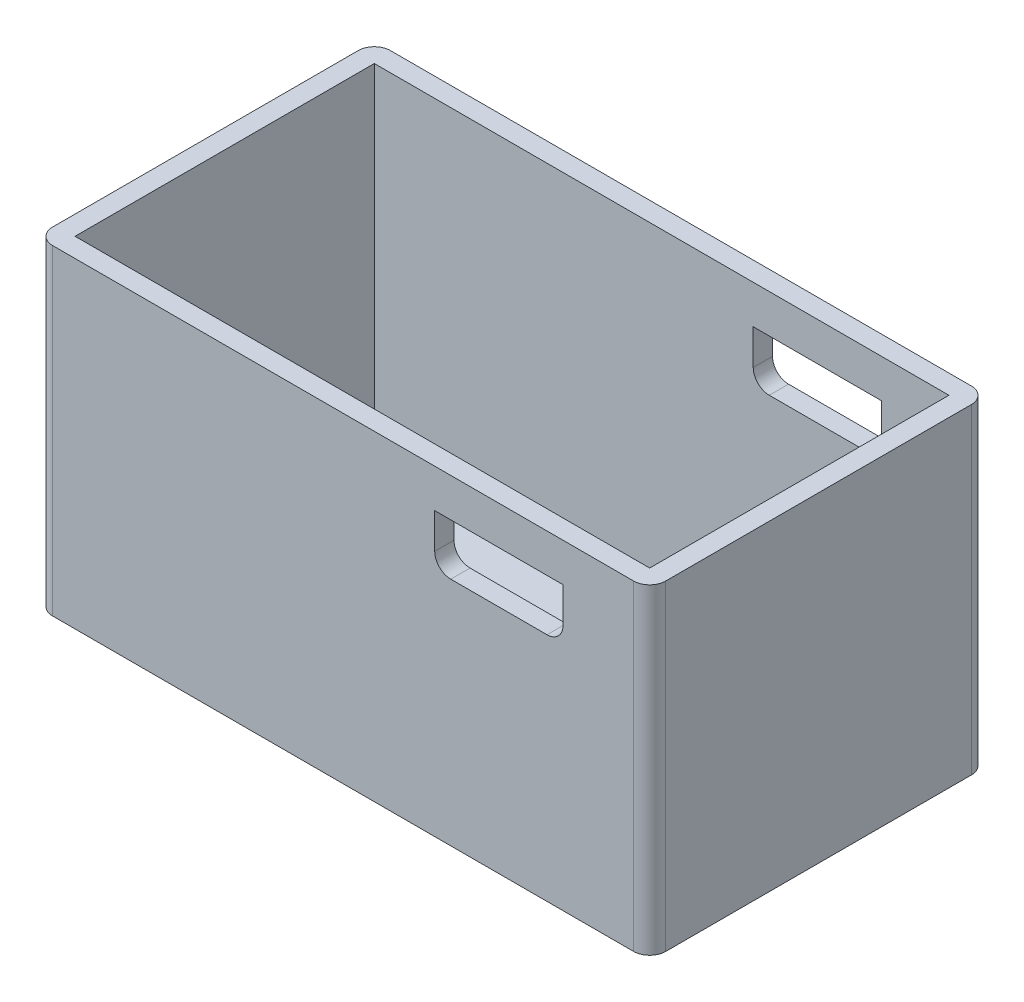
from build123d import *

# Parameters (mm, degrees)
SKETCH1_W           = 24.2700048
SKETCH1_H           = 13.3700012
BOSS_EXTRUDE1_DEPTH = 12.7
SHELL1_T            = -0.762
FILLET1_R           = 0.635
SKETCH2_W           = 5.08
SKETCH2_H           = 2.032
CUT_EXTRUDE1_DEPTH  = 23.074990721
FILLET2_R           = 0.635


with BuildPart() as part:
    # Sketch1 → Boss-Extrude1 (new body)
    with BuildSketch(Plane(origin=(0, 0, 0), x_dir=(1, 0, 0), z_dir=(0, 1, 0))):
        Rectangle(SKETCH1_W, SKETCH1_H)
    extrude(amount=BOSS_EXTRUDE1_DEPTH)

    # Shell1
    shell1_openings = [part.faces().sort_by_distance(p)[0] for p in [
        (0, 12.7, 0),
    ]]
    offset(amount=SHELL1_T, openings=shell1_openings, kind=Kind.INTERSECTION)

    # Fillet1
    fillet1_edges = [part.edges().sort_by_distance(p)[0] for p in [
        (12.1350024, 6.35, 6.6850006),
        (-12.1350024, 6.35, 6.6850006),
        (-12.1350024, 6.35, -6.6850006),
        (12.1350024, 6.35, -6.6850006),
    ]]
    fillet(fillet1_edges, radius=FILLET1_R)

    # Sketch2 → Cut-Extrude1 (cut, through all)
    with BuildSketch(Plane.XY.offset(6.6850006)):
        with Locations((6.1660024, 10.16)):
            Rectangle(SKETCH2_W, SKETCH2_H)
    extrude(amount=-CUT_EXTRUDE1_DEPTH, mode=Mode.SUBTRACT)

    # Fillet2
    fillet2_edges = [part.edges().sort_by_distance(p)[0] for p in [
        (8.7060024, 9.144, -6.3040006),
        (3.6260024, 9.144, -6.3040006),
        (8.7060024, 9.144, 6.3040006),
        (3.6260024, 9.144, 6.3040006),
    ]]
    fillet(fillet2_edges, radius=FILLET2_R)


solid = part.part
